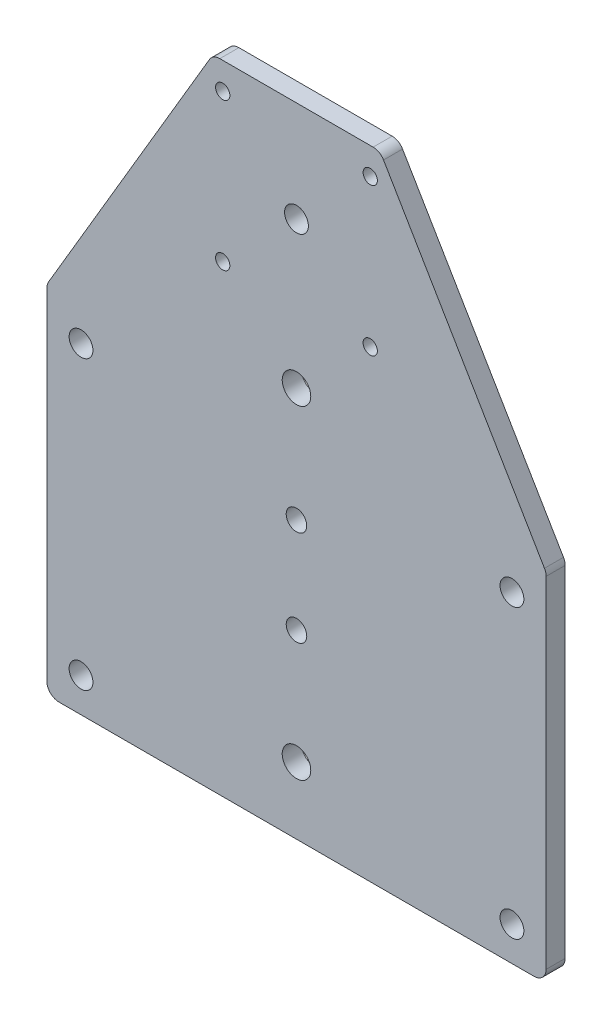
from build123d import *

# Parameters (mm, degrees)
SKETCH4_R           = 2.5
SKETCH4_R_2         = 1.5
BOSS_EXTRUDE1_DEPTH = 4
SKETCH5_R           = 2.159
SKETCH5_R_2         = 3
CUT_EXTRUDE1_DEPTH  = 4
FILLET1_R           = 2.54


with BuildPart() as part:
    # Sketch4 → Boss-Extrude1 (new body)
    with BuildSketch(Plane.XY):
        Polygon((-52.467947032, -38.099537239), (-52.467947032, -112.867947032), (52.467947032, -112.867947032), (52.467947032, -38.099537239), (17.557897552, 21.15), (-17.557897552, 21.15), align=None)
        with Locations((-45.283742135, -45.283742135)):
            Circle(SKETCH4_R, mode=Mode.SUBTRACT)
        with Locations((45.283742135, -45.283742135)):
            Circle(SKETCH4_R, mode=Mode.SUBTRACT)
        with Locations((45.283742135, -105.683742135)):
            Circle(SKETCH4_R, mode=Mode.SUBTRACT)
        with Locations((-45.283742135, -105.683742135)):
            Circle(SKETCH4_R, mode=Mode.SUBTRACT)
        with Locations((-15.5, -15.5)):
            Circle(SKETCH4_R_2, mode=Mode.SUBTRACT)
        with Locations((-15.5, 15.5)):
            Circle(SKETCH4_R_2, mode=Mode.SUBTRACT)
        with Locations((15.5, 15.5)):
            Circle(SKETCH4_R_2, mode=Mode.SUBTRACT)
        with Locations((15.5, -15.5)):
            Circle(SKETCH4_R_2, mode=Mode.SUBTRACT)
        Circle(SKETCH4_R, mode=Mode.SUBTRACT)
    extrude(amount=BOSS_EXTRUDE1_DEPTH)

    # Sketch5 → Cut-Extrude1 (cut)
    with BuildSketch(Plane.XY.offset(4)):
        with Locations((0, -54.767742135)):
            Circle(SKETCH5_R)
        with Locations((0, -74.833742135)):
            Circle(SKETCH5_R)
        with Locations((0, -30.767742135)):
            Circle(SKETCH5_R_2)
        with Locations((0, -98.833742135)):
            Circle(SKETCH5_R_2)
    extrude(amount=-CUT_EXTRUDE1_DEPTH, mode=Mode.SUBTRACT)

    # Fillet1
    fillet1_edges = [part.edges().sort_by_distance(p)[0] for p in [
        (-52.467947032, -38.099537239, 2),
        (-17.557897552, 21.15, 2),
        (17.557897552, 21.15, 2),
        (52.467947032, -38.099537239, 2),
        (52.467947032, -112.867947032, 2),
        (-52.467947032, -112.867947032, 2),
    ]]
    fillet(fillet1_edges, radius=FILLET1_R)


solid = part.part
